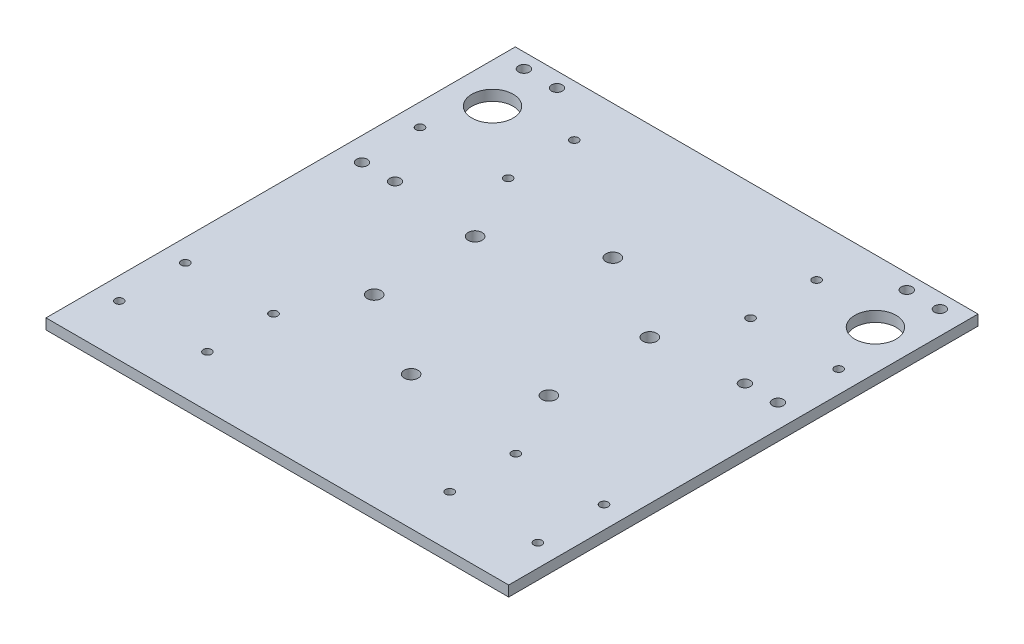
from build123d import *

# Parameters (mm, degrees)
SKETCH1_W           = 140
SKETCH1_H           = 142
BOSS_EXTRUDE1_DEPTH = 3.175
SKETCH2_R           = 6.25
SKETCH2_R_2         = 1.65
SKETCH2_R_3         = 1.25
CUT_EXTRUDE1_DEPTH  = 3.175
SKETCH4_R           = 2.1
CUT_EXTRUDE2_DEPTH  = 3.175


with BuildPart() as part:
    # Sketch1 → Boss-Extrude1 (new body)
    with BuildSketch(Plane(origin=(0, 0, 0), x_dir=(1, 0, 0), z_dir=(0, 1, 0))):
        Rectangle(SKETCH1_W, SKETCH1_H)
    extrude(amount=BOSS_EXTRUDE1_DEPTH)

    # Sketch2 → Cut-Extrude1 (cut)
    with BuildSketch(Plane(origin=(0, 3.175, 0), x_dir=(1, 0, 0), z_dir=(0, 1, 0))):
        with Locations(Location((-57.9286, 52.0357, 0), (0, 0, 270))):
            Circle(SKETCH2_R)
        with Locations(Location((-62.9286, 66.5357, 0), (0, 0, 270))):
            Circle(SKETCH2_R_2)
        with Locations(Location((-52.9286, 66.5357, 0), (0, 0, 90))):
            Circle(SKETCH2_R_2)
        with Locations(Location((-52.9286, 17.5357, 0), (0, 0, 270))):
            Circle(SKETCH2_R_2)
        with Locations(Location((-62.9286, 17.5357, 0), (0, 0, 90))):
            Circle(SKETCH2_R_2)
        with Locations(Location((52.9286, 17.5357, 0), (0, 0, 90))):
            Circle(SKETCH2_R_2)
        with Locations(Location((62.9286, 17.5357, 0), (0, 0, 270))):
            Circle(SKETCH2_R_2)
        with Locations(Location((57.9286, 52.0357, 0), (0, 0, 90))):
            Circle(SKETCH2_R)
        with Locations(Location((52.9286, 66.5357, 0), (0, 0, 270))):
            Circle(SKETCH2_R_2)
        with Locations(Location((62.9286, 66.5357, 0), (0, 0, 90))):
            Circle(SKETCH2_R_2)
        with Locations(Location((-36.666666667, 55.5, 0), (0, 0, 270))):
            Circle(SKETCH2_R_3)
        with Locations(Location((-36.666666667, 35.5, 0), (0, 0, 90))):
            Circle(SKETCH2_R_3)
        with Locations(Location((-63.333333333, 35.5, 0), (0, 0, 270))):
            Circle(SKETCH2_R_3)
        with Locations(Location((36.666666667, 35.5, 0), (0, 0, 270))):
            Circle(SKETCH2_R_3)
        with Locations(Location((63.333333333, 35.5, 0), (0, 0, 90))):
            Circle(SKETCH2_R_3)
        with Locations(Location((36.666666667, 55.5, 0), (0, 0, 90))):
            Circle(SKETCH2_R_3)
        with Locations(Location((63.333333333, -35.5, 0), (0, 0, 270))):
            Circle(SKETCH2_R_3)
        with Locations(Location((36.666666667, -35.5, 0), (0, 0, 90))):
            Circle(SKETCH2_R_3)
        with Locations(Location((63.333333333, -55.5, 0), (0, 0, 90))):
            Circle(SKETCH2_R_3)
        with Locations(Location((36.666666667, -55.5, 0), (0, 0, 270))):
            Circle(SKETCH2_R_3)
        with Locations(Location((-36.666666667, -35.5, 0), (0, 0, 270))):
            Circle(SKETCH2_R_3)
        with Locations(Location((-63.333333333, -35.5, 0), (0, 0, 90))):
            Circle(SKETCH2_R_3)
        with Locations(Location((-36.666666667, -55.5, 0), (0, 0, 90))):
            Circle(SKETCH2_R_3)
        with Locations(Location((-63.333333333, -55.5, 0), (0, 0, 270))):
            Circle(SKETCH2_R_3)
    extrude(amount=-CUT_EXTRUDE1_DEPTH, mode=Mode.SUBTRACT)

    # Sketch4 → Cut-Extrude2 (cut)
    with BuildSketch(Plane(origin=(0, 3.175, 0), x_dir=(1, 0, 0), z_dir=(0, 1, 0))):
        with Locations(Location((0, 30.525, 0), (0, 0, 270))):
            Circle(SKETCH4_R)
        with Locations(Location((26.435425451, 15.2625, 0), (0, 0, 270))):
            Circle(SKETCH4_R)
        with Locations(Location((26.435425451, -15.2625, 0), (0, 0, 270))):
            Circle(SKETCH4_R)
        with Locations(Location((0, -30.525, 0), (0, 0, 270))):
            Circle(SKETCH4_R)
        with Locations(Location((-26.435425451, -15.2625, 0), (0, 0, 270))):
            Circle(SKETCH4_R)
        with Locations(Location((-26.435425451, 15.2625, 0), (0, 0, 270))):
            Circle(SKETCH4_R)
    extrude(amount=-CUT_EXTRUDE2_DEPTH, mode=Mode.SUBTRACT)


solid = part.part
